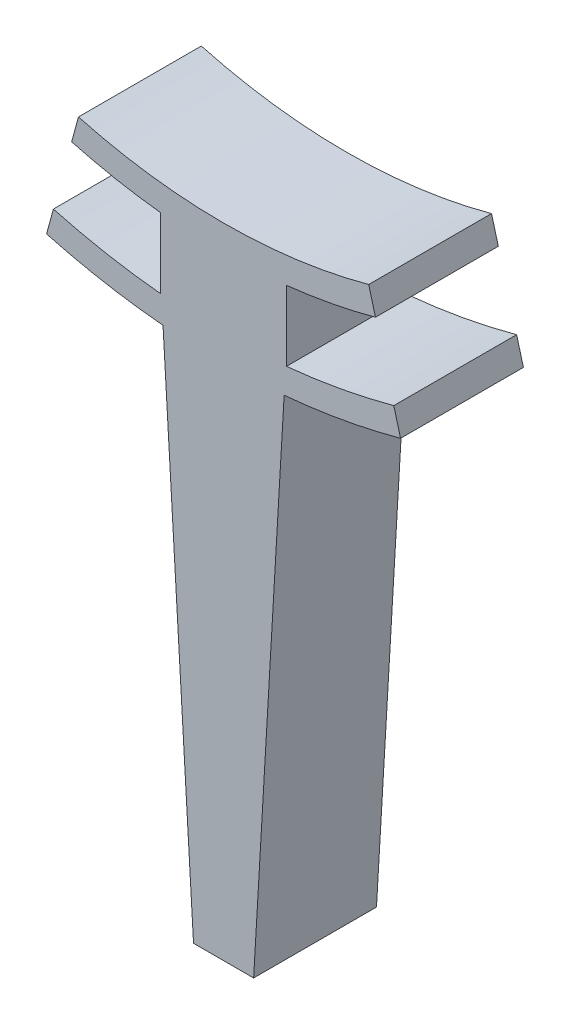
from build123d import *

# Parameters (mm, degrees)
BOSS_EXTRUDE1_DEPTH = 9.5


with BuildPart() as part:
    # Sketch1 → Boss-Extrude1 (new body)
    with BuildSketch(Plane.XY):
        with BuildLine():
            Line((-5.165155755, -27.675045296), (-5.165155755, -33.10368941))
            ThreePointArc((-5.165155755, -33.10368941), (-9.346333037, -32.518171884), (-13.463522621, -31.583386259))
            Line((-13.463522621, -31.583386259), (-13.987965753, -33.513401647))
            ThreePointArc((-13.987965753, -33.513401647), (-9.521266094, -34.519064332), (-4.983625309, -35.129457142))
            Line((-4.983625309, -35.129457142), (-2.624414585, -75.34))
            Line((-2.624414585, -75.34), (2.024414585, -75.34))
            Line((2.024414585, -75.34), (4.383625309, -35.129457142))
            ThreePointArc((4.383625309, -35.129457142), (8.921266094, -34.519064332), (13.387965753, -33.513401647))
            Line((13.387965753, -33.513401647), (12.863522621, -31.583386259))
            ThreePointArc((12.863522621, -31.583386259), (8.746333037, -32.518171884), (4.565155755, -33.10368941))
            Line((4.565155755, -33.10368941), (4.565155755, -27.675045296))
            ThreePointArc((4.565155755, -27.675045296), (8.031839973, -27.15841027), (11.447526164, -26.372344709))
            Line((11.447526164, -26.372344709), (10.923083031, -24.44232932))
            ThreePointArc((10.923083031, -24.44232932), (-0.3, -25.94), (-11.523083031, -24.44232932))
            Line((-11.523083031, -24.44232932), (-12.047526164, -26.372344709))
            ThreePointArc((-12.047526164, -26.372344709), (-8.631839973, -27.15841027), (-5.165155755, -27.675045296))
        make_face()
    extrude(amount=-BOSS_EXTRUDE1_DEPTH)


solid = part.part
